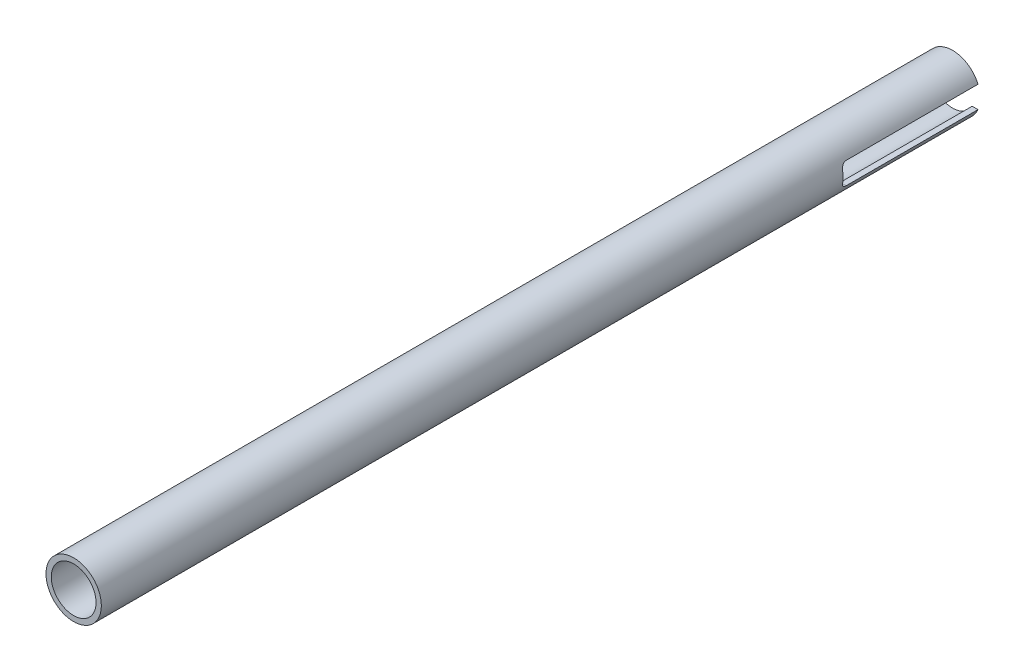
from build123d import *

# Parameters (mm, degrees)
SKETCH1_R               = 8.001
SKETCH1_R_2             = 6.477
BOSS_EXTRUDE1_DEPTH     = 254
CUT_EXTRUDE2_DEPTH      = 255.251906585
CUT_EXTRUDE2_DEPTH_BACK = 255.251906585


with BuildPart() as part:
    # Sketch1 → Boss-Extrude1 (new body)
    with BuildSketch(Plane.XY):
        Circle(SKETCH1_R)
        Circle(SKETCH1_R_2, mode=Mode.SUBTRACT)
    extrude(amount=BOSS_EXTRUDE1_DEPTH)

    # Sketch2 → Cut-Extrude2 (cut, two sides: drawn at the far end of the back side and taken through both)
    with BuildSketch(Plane(origin=(0, 0, 0), x_dir=(0, 0, -1), z_dir=(1, 0, 0)).offset(-CUT_EXTRUDE2_DEPTH_BACK)):
        with BuildLine():
            Line((518.491506226, 3.175), (0, 3.175))
            Line((0, 3.175), (-38.1, 3.175))
            ThreePointArc((-38.1, 3.175), (-39.177630735, 2.728630735), (-39.624, 1.651))
            Line((-39.624, 1.651), (-39.624, -1.651))
            ThreePointArc((-39.624, -1.651), (-39.177630735, -2.728630735), (-38.1, -3.175))
            Line((-38.1, -3.175), (0, -3.175))
            Line((0, -3.175), (518.491506226, -3.175))
            Line((518.491506226, -3.175), (1555.474518678, -3.175))
            Line((1555.474518678, -3.175), (1555.474518678, 3.175))
            Line((1555.474518678, 3.175), (518.491506226, 3.175))
        make_face()
    extrude(amount=CUT_EXTRUDE2_DEPTH + CUT_EXTRUDE2_DEPTH_BACK, mode=Mode.SUBTRACT)


solid = part.part
